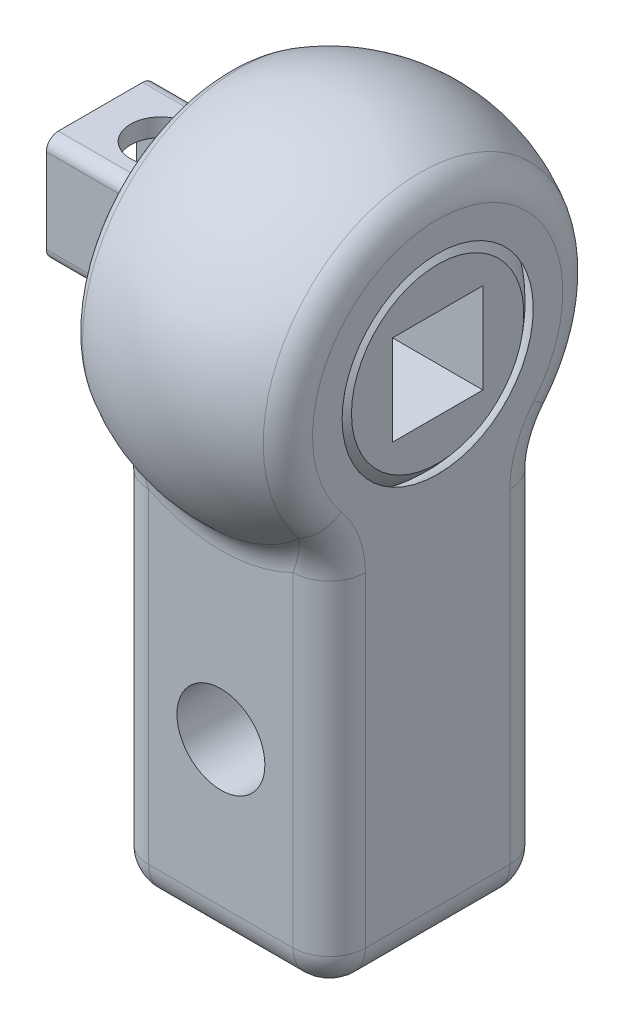
from build123d import *

# Parameters (mm, degrees)
CORTAR_EXTRUIR1_DEPTH        = 61.819404798
CORTAR_EXTRUIR1_DEPTH_BACK   = 61.819404798
SALIENTE_EXTRUIR1_REACH      = 61.624
SALIENTE_EXTRUIR1_END_RADIUS = 15
CROQUIS3_W                   = 18
CROQUIS3_H                   = 18
CORTAR_EXTRUIR2_DEPTH        = 62.627915753
CORTAR_EXTRUIR2_DEPTH_BACK   = 62.627915753
CROQUIS4_W                   = 7.5
CROQUIS4_H                   = 7.5
CROQUIS5_W                   = 9
CROQUIS5_H                   = 9
CROQUIS5_W_2                 = 6
CROQUIS5_H_2                 = 6
SALIENTE_EXTRUIR2_DEPTH      = 10
CORTAR_EXTRUIR3_DEPTH        = 65.699304478
CORTAR_EXTRUIR3_DEPTH_BACK   = 65.699304478
CROQUIS7_R                   = 3.65
REDONDEO1_R                  = 3
CROQUIS8_R                   = 2.5
CORTAR_EXTRUIR4_DEPTH        = 10
REDONDEO2_R                  = 1
REDONDEO3_R                  = 0.5


with BuildPart() as part:
    # Croquis1 → Revolución1 (revolve)
    with BuildSketch(Plane.XY):
        with BuildLine():
            Line((0, 27), (0, 30))
            ThreePointArc((0, 30), (12, 42), (0, 54))
            Line((0, 54), (0, 57))
            ThreePointArc((0, 57), (15, 42), (0, 27))
        make_face()
        with BuildLine():
            Line((0, 30.5), (0, 53.5))
            ThreePointArc((0, 53.5), (11.5, 42), (0, 30.5))
        make_face()
    revolve(axis=Axis((0, 0, 0), (0, 1, 0)))

    # Croquis2 → Cortar-Extruir1 (cut, two sides: drawn at the far end of the back side and taken through both)
    with BuildSketch(Plane.XY.offset(-CORTAR_EXTRUIR1_DEPTH_BACK)):
        Polygon((-9, 42), (-9, 57), (-19, 57), (-19, 27), (-9, 27), align=None)
        Polygon((19, 27), (9, 27), (9, 42), (9, 57), (19, 57), align=None)
    extrude(amount=CORTAR_EXTRUIR1_DEPTH + CORTAR_EXTRUIR1_DEPTH_BACK, mode=Mode.SUBTRACT)

    # Saliente-Extruir1: up to this sphere (the profile starts outside it)
    saliente_extruir1_end = Location((0, 42, 0)) * Sphere(SALIENTE_EXTRUIR1_END_RADIUS, mode=Mode.PRIVATE)
    # Croquis3 → Saliente-Extruir1 (add, up to the surface)
    with BuildSketch(Plane(origin=(0, 0, 0), x_dir=(1, 0, 0), z_dir=(0, 1, 0)), mode=Mode.PRIVATE) as saliente_extruir1_sk1:
        Rectangle(CROQUIS3_W, CROQUIS3_H)
    saliente_extruir1_tool1 = extrude(saliente_extruir1_sk1.sketch, amount=SALIENTE_EXTRUIR1_REACH, mode=Mode.PRIVATE) - saliente_extruir1_end
    add(saliente_extruir1_tool1.solids().sort_by_distance((0, 0, 0))[0])

    # Croquis4 → Cortar-Extruir2 (cut, two sides: drawn at the far end of the back side and taken through both)
    with BuildSketch(Plane.ZY.offset(9).offset(-CORTAR_EXTRUIR2_DEPTH_BACK)):
        with Locations((0, 42)):
            Rectangle(CROQUIS4_W, CROQUIS4_H)
    extrude(amount=CORTAR_EXTRUIR2_DEPTH + CORTAR_EXTRUIR2_DEPTH_BACK, mode=Mode.SUBTRACT)

    # Croquis5 → Saliente-Extruir2 (add)
    with BuildSketch(Plane.ZY.offset(9)):
        with Locations((0, 42)):
            Rectangle(CROQUIS5_W, CROQUIS5_H)
        with Locations((0, 42)):
            Rectangle(CROQUIS5_W_2, CROQUIS5_H_2, mode=Mode.SUBTRACT)
    extrude(amount=SALIENTE_EXTRUIR2_DEPTH)

    # Croquis7 → Cortar-Extruir3 (cut, two sides: drawn at the far end of the back side and taken through both)
    with BuildSketch(Plane.XY.offset(9).offset(-CORTAR_EXTRUIR3_DEPTH_BACK)):
        with Locations((0, 15)):
            Circle(CROQUIS7_R)
    extrude(amount=CORTAR_EXTRUIR3_DEPTH + CORTAR_EXTRUIR3_DEPTH_BACK, mode=Mode.SUBTRACT)

    # Redondeo1
    redondeo1_edges = [part.edges().sort_by_distance(p)[0] for p in [
        (9, 46.937253933, 10.937253933),
        (-9, 54, 0),
        (0, 30, 9),
        (-9, 17.031373033, 9),
        (0, 0, 9),
        (-9, 17.031373033, -9),
        (-9, 0, 0),
        (0, 30, -9),
        (9, 17.031373033, -9),
        (0, 0, -9),
        (9, 17.031373033, 9),
        (9, 0, 0),
    ]]
    fillet(redondeo1_edges, radius=REDONDEO1_R)

    # Croquis8 → Cortar-Extruir4 (cut)
    with BuildSketch(Plane(origin=(0, 46.5, 0), x_dir=(1, 0, 0), z_dir=(0, 1, 0))):
        with Locations(Location((-14, 0, 0), (0, 0, 270))):
            Circle(CROQUIS8_R)
    extrude(amount=-CORTAR_EXTRUIR4_DEPTH, mode=Mode.SUBTRACT)

    # Redondeo2
    redondeo2_edges = [part.edges().sort_by_distance(p)[0] for p in [
        (-14, 37.5, 4.5),
        (-14, 46.5, 4.5),
        (-14, 46.5, -4.5),
        (-14, 37.5, -4.5),
    ]]
    fillet(redondeo2_edges, radius=REDONDEO2_R)

    # Redondeo3
    redondeo3_edges = [part.edges().sort_by_distance(p)[0] for p in [
        (-9, 37.792893219, 4.207106781),
        (-9, 37.792893219, -4.207106781),
        (-9, 46.207106781, -4.207106781),
        (-9, 46.207106781, 4.207106781),
        (-9, 42, 4.5),
        (-9, 37.5, 0),
        (-9, 42, -4.5),
        (-9, 46.5, 0),
    ]]
    fillet(redondeo3_edges, radius=REDONDEO3_R)


solid = part.part
